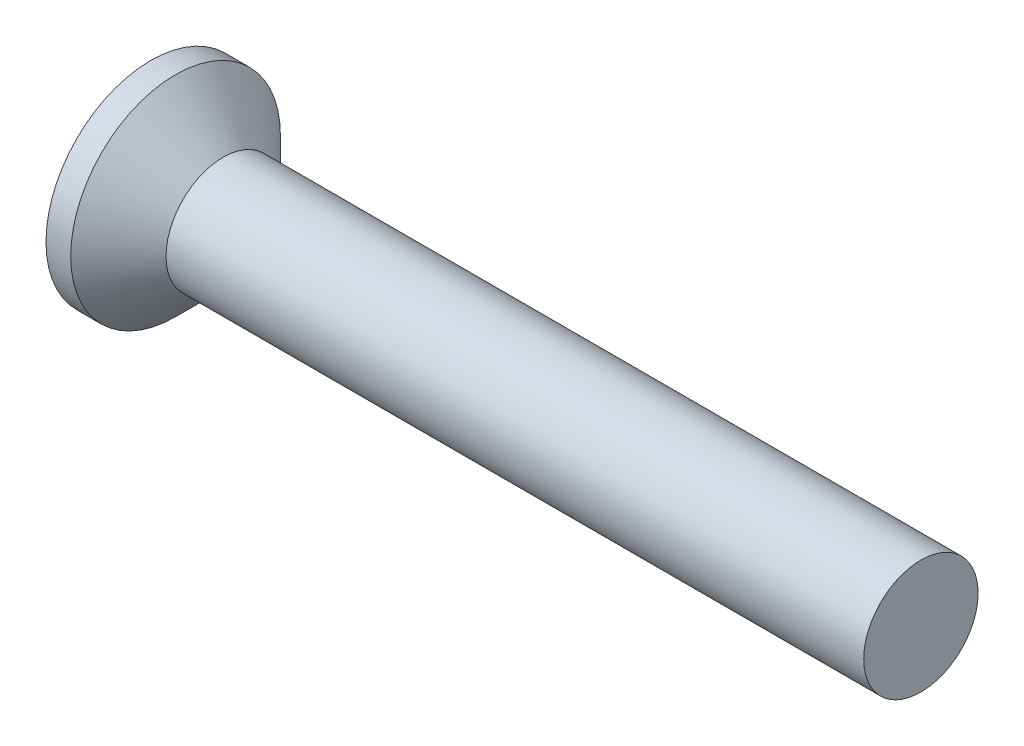
from build123d import *

# Parameters (mm, degrees)
CIRPATTERN1_COUNT = 2
CIRPATTERN1_ANGLE = 90


with BuildPart() as part:
    # BodySke → Base-Revolve (revolve)
    with BuildSketch(Plane.XY, mode=Mode.PRIVATE) as base_revolve_sk:
        with BuildLine():
            Line((0, 0), (20.727669073, 0))
            Line((20.727669073, 0), (20.727669073, 1.5))
            Line((20.727669073, 1.5), (2.427669073, 1.5))
            Line((2.427669073, 1.5), (1.177669073, 2.75))
            Line((1.177669073, 2.75), (0.529956332, 2.75))
            ThreePointArc((0.529956332, 2.75), (0.133696843, 1.400299407), (0, 0))
        make_face()
    revolve(base_revolve_sk.sketch.rotate(Axis((-15.875, 0, 0), (1, 0, 0)), 90), axis=Axis((-15.875, 0, 0), (1, 0, 0)))

    # Sketch3 → Cross section 0
    with BuildSketch(Plane(origin=(0, 0, 0), x_dir=(0, 0, -1), z_dir=(1, 0, 0))):
        with BuildLine():
            Line((0.415, -1.72), (-0.415, -1.72))
            Line((-0.415, -1.72), (-0.415, 1.72))
            Line((-0.415, 1.72), (0.415, 1.72))
            Line((0.415, 1.72), (0.415, -1.72))
        make_face()
    # Sketch4 → Cross section 1
    with BuildSketch(Plane(origin=(2.33, 0, 0), x_dir=(0, 0, -1), z_dir=(1, 0, 0))):
        with BuildLine():
            Line((0.2075, -0.2075), (-0.2075, -0.2075))
            Line((-0.2075, -0.2075), (-0.2075, 0.2075))
            Line((-0.2075, 0.2075), (0.2075, 0.2075))
            Line((0.2075, 0.2075), (0.2075, -0.2075))
        make_face()
    cross = loft(mode=Mode.SUBTRACT)

    # CirPattern1: Cross ×2 about axis
    cirpattern1_axis = Axis((0, 0, 0), (1, 0, 0))
    for i in range(1, CIRPATTERN1_COUNT):
        add(cross.rotate(cirpattern1_axis, i * CIRPATTERN1_ANGLE / (CIRPATTERN1_COUNT - 1)), mode=Mode.SUBTRACT)


solid = part.part
